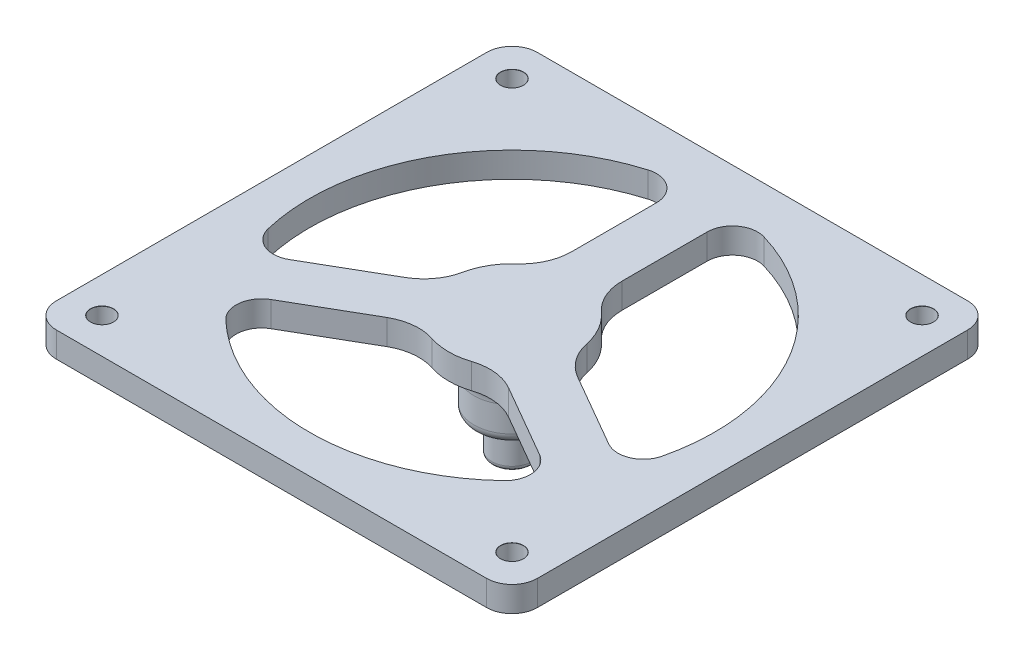
from build123d import *

# Parameters (mm, degrees)
SKETCH1_W                      = 95
SKETCH1_H                      = 95
BOSS_EXTRUDE1_DEPTH            = 5
FILLET1_R                      = 5
M4_CLEARANCE_HOLE1_D           = 4.5
M4_CLEARANCE_HOLE1_CSINK_D     = 4.55
M4_CLEARANCE_HOLE1_CSINK_ANGLE = 90
SKETCH5_R                      = 7.5
BOSS_EXTRUDE2_DEPTH            = 12
SKETCH6_R                      = 4
BOSS_EXTRUDE3_DEPTH            = 7
FILLET2_R                      = 2
FILLET3_R                      = 5
FILLET4_R                      = 1
CUT_EXTRUDE2_REACH             = 73.334
FILLET5_R                      = 5
FILLET6_R                      = 10


with BuildPart() as part:
    # Sketch1 → Boss-Extrude1 (new body)
    with BuildSketch(Plane(origin=(0, 0, 0), x_dir=(1, 0, 0), z_dir=(0, 1, 0))):
        Rectangle(SKETCH1_W, SKETCH1_H)
    extrude(amount=BOSS_EXTRUDE1_DEPTH)

    # Fillet1
    fillet1_edges = [part.edges().sort_by_distance(p)[0] for p in [
        (-47.50000000000001, 2.5, 47.5),
        (-47.50000000000001, 2.5, -47.5),
        (47.49999999999999, 2.5, -47.5),
        (47.49999999999999, 2.5, 47.5),
    ]]
    fillet(fillet1_edges, radius=FILLET1_R)

    # M4 Clearance Hole1 (through all)
    with Locations(Plane(origin=(-40.5, 5, -40.5), x_dir=(0, 0, 1), z_dir=(0, 1, 0))):
        with Locations((0, 0), (0, 81), (81, 81), (81, 0)):
            CounterSinkHole(M4_CLEARANCE_HOLE1_D / 2, M4_CLEARANCE_HOLE1_CSINK_D / 2, counter_sink_angle=M4_CLEARANCE_HOLE1_CSINK_ANGLE)

    # Sketch5 → Boss-Extrude2 (add)
    with BuildSketch(Plane.XZ):
        with Locations(Location((0, 0, 0), (0, 0, 90))):
            Circle(SKETCH5_R)
    extrude(amount=BOSS_EXTRUDE2_DEPTH)

    # Sketch6 → Boss-Extrude3 (add)
    with BuildSketch(Plane.XZ.offset(12)):
        with Locations(Location((0, 0, 0), (0, 0, 270))):
            Circle(SKETCH6_R)
    extrude(amount=BOSS_EXTRUDE3_DEPTH)

    # Fillet2
    fillet2_edges = [part.edges().sort_by_distance(p)[0] for p in [
        (-4.71e-15, -12, -7.5),
    ]]
    fillet(fillet2_edges, radius=FILLET2_R)

    # Fillet3
    fillet3_edges = [part.edges().sort_by_distance(p)[0] for p in [
        (-4.71e-15, 0, -7.5),
    ]]
    fillet(fillet3_edges, radius=FILLET3_R)

    # Fillet4
    fillet4_edges = [part.edges().sort_by_distance(p)[0] for p in [
        (1.22e-15, -19, 4),
    ]]
    fillet(fillet4_edges, radius=FILLET4_R)

    # Sketch2 → Cut-Extrude2 (cut, up to next)
    with BuildSketch(Plane(origin=(0, 5, 0), x_dir=(1, 0, 0), z_dir=(0, 1, 0)), mode=Mode.PRIVATE) as cut_extrude2_sk1:
        with BuildLine():
            Line((5.000000000000003, 39.68626966596886), (4.999999999999999, 11.456439237389601))
            ThreePointArc((4.999999999999999, 11.456439237389601), (10.8253175473055, 6.249999999999979), (12.421567416492215, -1.398092599772662))
            Line((12.421567416492215, -1.398092599772662), (36.86931771216872, -15.51300781406241))
            ThreePointArc((36.86931771216872, -15.51300781406241), (34.64101615137759, 19.99999999999991), (5.000000000000003, 39.68626966596886))
        make_face()
    cut_extrude2_tool1 = extrude(cut_extrude2_sk1.sketch, amount=-CUT_EXTRUDE2_REACH, mode=Mode.PRIVATE) & part.part
    # Sketch2 → Cut-Extrude2 (cut, up to next)
    with BuildSketch(Plane(origin=(0, 5, 0), x_dir=(1, 0, 0), z_dir=(0, 1, 0)), mode=Mode.PRIVATE) as cut_extrude2_sk2:
        with BuildLine():
            Line((-5.000000000000003, 39.68626966596886), (-4.999999999999999, 11.456439237389601))
            ThreePointArc((-4.999999999999999, 11.456439237389601), (-10.825317547305497, 6.249999999999976), (-12.42156741649221, -1.3980925997726692))
            Line((-12.42156741649221, -1.3980925997726692), (-36.86931771216872, -15.513007814062414))
            ThreePointArc((-36.86931771216872, -15.513007814062414), (-34.64101615137759, 19.999999999999922), (-5.000000000000003, 39.68626966596886))
        make_face()
    cut_extrude2_tool2 = extrude(cut_extrude2_sk2.sketch, amount=-CUT_EXTRUDE2_REACH, mode=Mode.PRIVATE) & part.part
    # Sketch2 → Cut-Extrude2 (cut, up to next)
    with BuildSketch(Plane(origin=(0, 5, 0), x_dir=(1, 0, 0), z_dir=(0, 1, 0)), mode=Mode.PRIVATE) as cut_extrude2_sk3:
        with BuildLine():
            Line((-7.4215674164921674, -10.058346637617028), (-31.86931771216868, -24.173261851906783))
            ThreePointArc((-31.86931771216868, -24.173261851906783), (2.45e-15, -40), (31.869317712168694, -24.173261851906773))
            Line((31.869317712168694, -24.173261851906773), (7.421567416492171, -10.058346637617028))
            ThreePointArc((7.421567416492171, -10.058346637617028), (7.7e-16, -12.5), (-7.4215674164921674, -10.058346637617028))
        make_face()
    cut_extrude2_tool3 = extrude(cut_extrude2_sk3.sketch, amount=-CUT_EXTRUDE2_REACH, mode=Mode.PRIVATE) & part.part
    add(cut_extrude2_tool1.solids().sort_by_distance((22.174901, 5, -12.802685))[0], mode=Mode.SUBTRACT)
    add(cut_extrude2_tool2.solids().sort_by_distance((-22.174901, 5, -12.802685))[0], mode=Mode.SUBTRACT)
    add(cut_extrude2_tool3.solids().sort_by_distance((0, 5, 25.60537))[0], mode=Mode.SUBTRACT)

    # Fillet5
    fillet5_edges = [part.edges().sort_by_distance(p)[0] for p in [
        (-36.86931771216872, 2.5, 15.513007814062414),
        (-4.999999999999998, 2.5, -39.68626966596885),
        (31.869317712168694, 2.5, 24.173261851906776),
        (-31.869317712168684, 2.5, 24.173261851906787),
        (5.000000000000002, 2.5, -39.68626966596885),
        (36.86931771216872, 2.5, 15.51300781406241),
    ]]
    fillet(fillet5_edges, radius=FILLET5_R)

    # Fillet6
    fillet6_edges = [part.edges().sort_by_distance(p)[0] for p in [
        (-4.999999999999998, 2.5, -11.456439237389603),
        (-12.42156741649221, 2.5, 1.398092599772669),
        (-7.421567416492167, 2.5, 10.058346637617028),
        (7.42156741649217, 2.5, 10.058346637617026),
        (12.421567416492213, 2.5, 1.3980925997726628),
        (4.999999999999999, 2.5, -11.4564392373896),
    ]]
    fillet(fillet6_edges, radius=FILLET6_R)


solid = part.part
